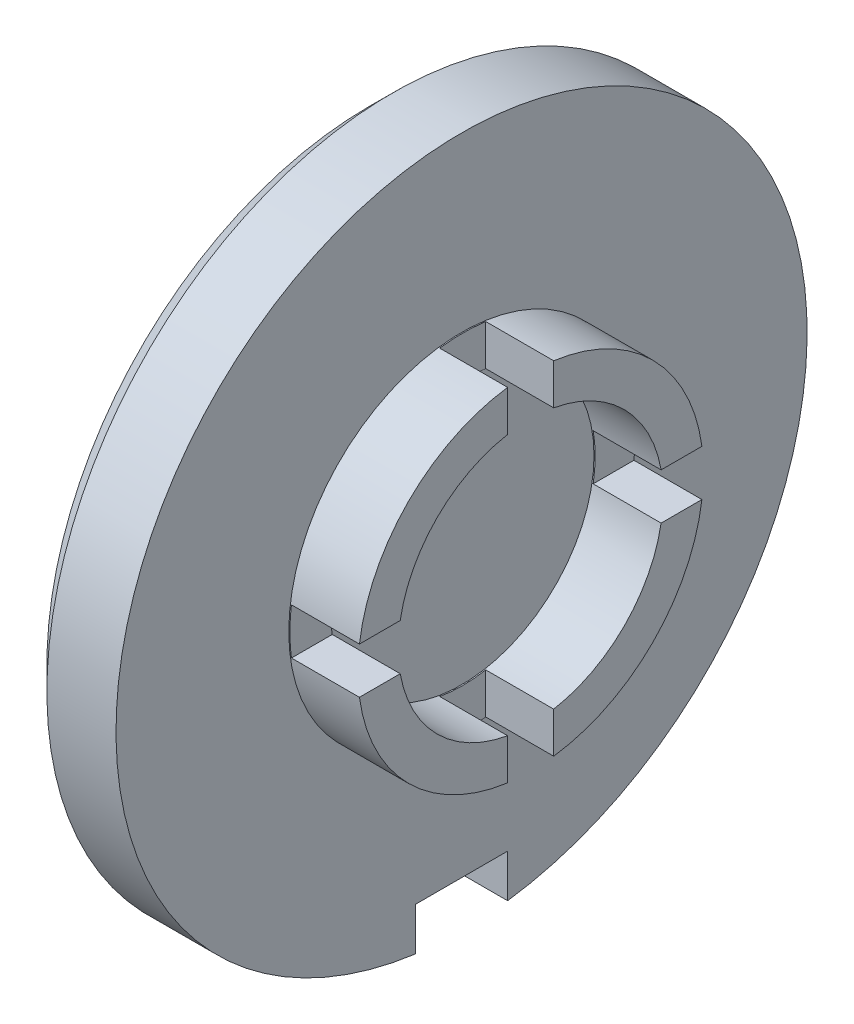
from build123d import *

# Parameters (mm, degrees)
BOSS_EXTRUDE1_START = -55.2
SKETCH2_W           = 1.28
SKETCH2_H           = 0.8
BOSS_EXTRUDE1_DEPTH = 6.4
BOSS_EXTRUDE2_START = -52.4
SKETCH3_W           = 1.28
SKETCH3_H           = 6.4
BOSS_EXTRUDE2_DEPTH = 0.8
BOSS_EXTRUDE3_START = -52.8
SKETCH4_W           = 1.8
SKETCH4_H           = 0.9
BOSS_EXTRUDE3_DEPTH = 1.6


with BuildPart() as part:
    # Sketch1 → Revolve1 (revolve)
    with BuildSketch(Plane.XY.offset(-52), mode=Mode.PRIVATE) as revolve1_sk:
        Polygon((-58.2, 20.3), (-59.4, 20.3), (-59.4, 18), (-61, 18), (-61, 23.6), (-60.6, 24), (-59.4, 24), (-59.4, 21), (-58.2, 21), align=None)
    revolve(revolve1_sk.sketch.rotate(Axis((-66, 18, -52), (1, 0, 0)), 90), axis=Axis((-66, 18, -52), (1, 0, 0)))


with BuildPart() as body_2:
    # Sketch2 → Boss-Extrude1 (new body)
    with BuildSketch(Plane.XY.offset(BOSS_EXTRUDE1_START)):
        with Locations((-58.74, 18)):
            Rectangle(SKETCH2_W, SKETCH2_H)
    extrude(amount=BOSS_EXTRUDE1_DEPTH)


with BuildPart() as part_1:
    add(part.part)

    # Combine1: cut body 2
    add(body_2.part, mode=Mode.SUBTRACT)


with BuildPart() as body_2_2:
    # Sketch3 → Boss-Extrude2 (new body)
    with BuildSketch(Plane.XY.offset(BOSS_EXTRUDE2_START)):
        with Locations((-58.74, 18)):
            Rectangle(SKETCH3_W, SKETCH3_H)
    extrude(amount=BOSS_EXTRUDE2_DEPTH)


with BuildPart() as part_2:
    add(part_1.part)

    # Combine2: cut body 2 2
    add(body_2_2.part, mode=Mode.SUBTRACT)


with BuildPart() as body_2_3:
    # Sketch4 → Boss-Extrude3 (new body)
    with BuildSketch(Plane.XY.offset(BOSS_EXTRUDE3_START)):
        with Locations((-60.2, 12.35)):
            Rectangle(SKETCH4_W, SKETCH4_H)
    extrude(amount=BOSS_EXTRUDE3_DEPTH)


with BuildPart() as part_3:
    add(part_2.part)

    # Combine3: cut body 2 3
    add(body_2_3.part, mode=Mode.SUBTRACT)


solid = part_3.part
